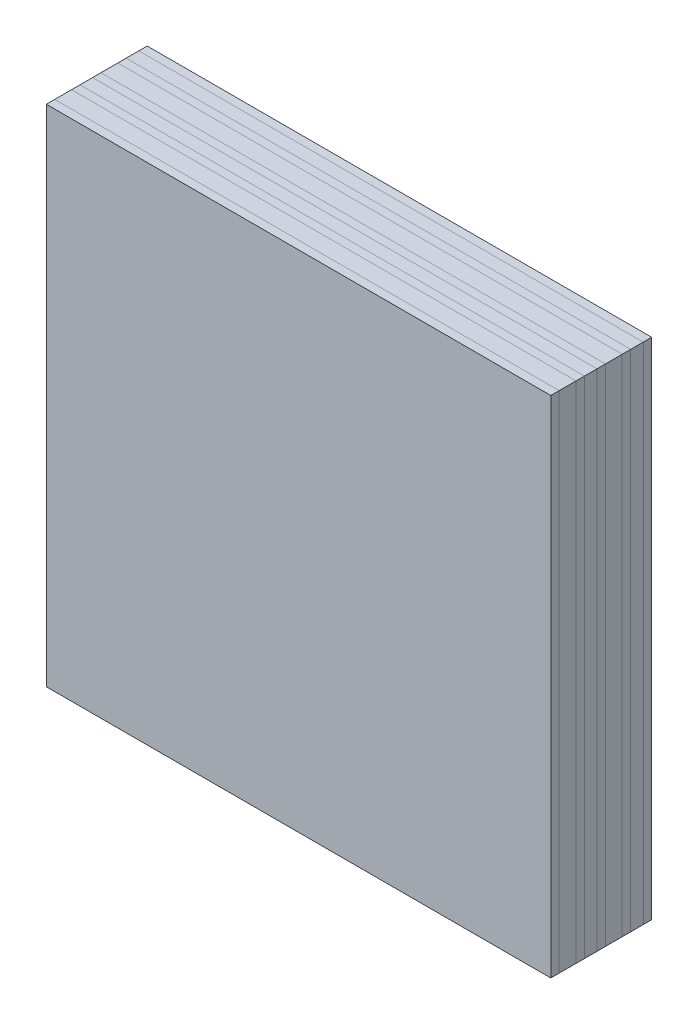
from build123d import *

# Parameters (mm, degrees)
SKETCH_LAYEROUTLINE_W   = 60
SKETCH_LAYEROUTLINE_H   = 60
LAYER1_DEPTH            = 1
LAYER2_START            = 1
SKETCH_LAYEROUTLINE_2_W = 60
SKETCH_LAYEROUTLINE_2_H = 60
LAYER2_DEPTH            = 1.5
LAYER3_START            = 2.5
SKETCH_LAYEROUTLINE_3_W = 60
SKETCH_LAYEROUTLINE_3_H = 60
LAYER3_DEPTH            = 1
LAYER4_START            = 3.5
SKETCH_LAYEROUTLINE_4_W = 60
SKETCH_LAYEROUTLINE_4_H = 60
LAYER4_DEPTH            = 2
LAYER5_START            = 5.5
SKETCH_LAYEROUTLINE_5_W = 60
SKETCH_LAYEROUTLINE_5_H = 60
LAYER5_DEPTH            = 1
LAYER6_START            = 6.5
SKETCH_LAYEROUTLINE_6_W = 60
SKETCH_LAYEROUTLINE_6_H = 60
LAYER6_DEPTH            = 1.5
LAYER7_START            = 8
SKETCH_LAYEROUTLINE_7_W = 60
SKETCH_LAYEROUTLINE_7_H = 60
LAYER7_DEPTH            = 1
LAYER8_START            = 9
SKETCH_LAYEROUTLINE_8_W = 60
SKETCH_LAYEROUTLINE_8_H = 60
LAYER8_DEPTH            = 2
LAYER9_START            = 11
SKETCH_LAYEROUTLINE_9_W = 60
SKETCH_LAYEROUTLINE_9_H = 60
LAYER9_DEPTH            = 1


with BuildPart() as part:
    # Sketch_LayerOutline → Layer1 (new body)
    with BuildSketch(Plane.XY):
        Rectangle(SKETCH_LAYEROUTLINE_W, SKETCH_LAYEROUTLINE_H)
    extrude(amount=LAYER1_DEPTH)


with BuildPart() as body_2:
    # Sketch_LayerOutline<2> → Layer2 (new body)
    with BuildSketch(Plane.XY.offset(LAYER2_START)):
        Rectangle(SKETCH_LAYEROUTLINE_2_W, SKETCH_LAYEROUTLINE_2_H)
    extrude(amount=LAYER2_DEPTH)


with BuildPart() as body_3:
    # Sketch_LayerOutline<3> → Layer3 (new body)
    with BuildSketch(Plane.XY.offset(LAYER3_START)):
        Rectangle(SKETCH_LAYEROUTLINE_3_W, SKETCH_LAYEROUTLINE_3_H)
    extrude(amount=LAYER3_DEPTH)


with BuildPart() as body_4:
    # Sketch_LayerOutline<4> → Layer4 (new body)
    with BuildSketch(Plane.XY.offset(LAYER4_START)):
        Rectangle(SKETCH_LAYEROUTLINE_4_W, SKETCH_LAYEROUTLINE_4_H)
    extrude(amount=LAYER4_DEPTH)


with BuildPart() as body_5:
    # Sketch_LayerOutline<5> → Layer5 (new body)
    with BuildSketch(Plane.XY.offset(LAYER5_START)):
        Rectangle(SKETCH_LAYEROUTLINE_5_W, SKETCH_LAYEROUTLINE_5_H)
    extrude(amount=LAYER5_DEPTH)


with BuildPart() as body_6:
    # Sketch_LayerOutline<6> → Layer6 (new body)
    with BuildSketch(Plane.XY.offset(LAYER6_START)):
        Rectangle(SKETCH_LAYEROUTLINE_6_W, SKETCH_LAYEROUTLINE_6_H)
    extrude(amount=LAYER6_DEPTH)


with BuildPart() as body_7:
    # Sketch_LayerOutline<7> → Layer7 (new body)
    with BuildSketch(Plane.XY.offset(LAYER7_START)):
        Rectangle(SKETCH_LAYEROUTLINE_7_W, SKETCH_LAYEROUTLINE_7_H)
    extrude(amount=LAYER7_DEPTH)


with BuildPart() as body_8:
    # Sketch_LayerOutline<8> → Layer8 (new body)
    with BuildSketch(Plane.XY.offset(LAYER8_START)):
        Rectangle(SKETCH_LAYEROUTLINE_8_W, SKETCH_LAYEROUTLINE_8_H)
    extrude(amount=LAYER8_DEPTH)


with BuildPart() as body_9:
    # Sketch_LayerOutline<9> → Layer9 (new body)
    with BuildSketch(Plane.XY.offset(LAYER9_START)):
        Rectangle(SKETCH_LAYEROUTLINE_9_W, SKETCH_LAYEROUTLINE_9_H)
    extrude(amount=LAYER9_DEPTH)


solid = Compound([part.part, body_2.part, body_3.part, body_4.part, body_5.part, body_6.part, body_7.part, body_8.part, body_9.part])
